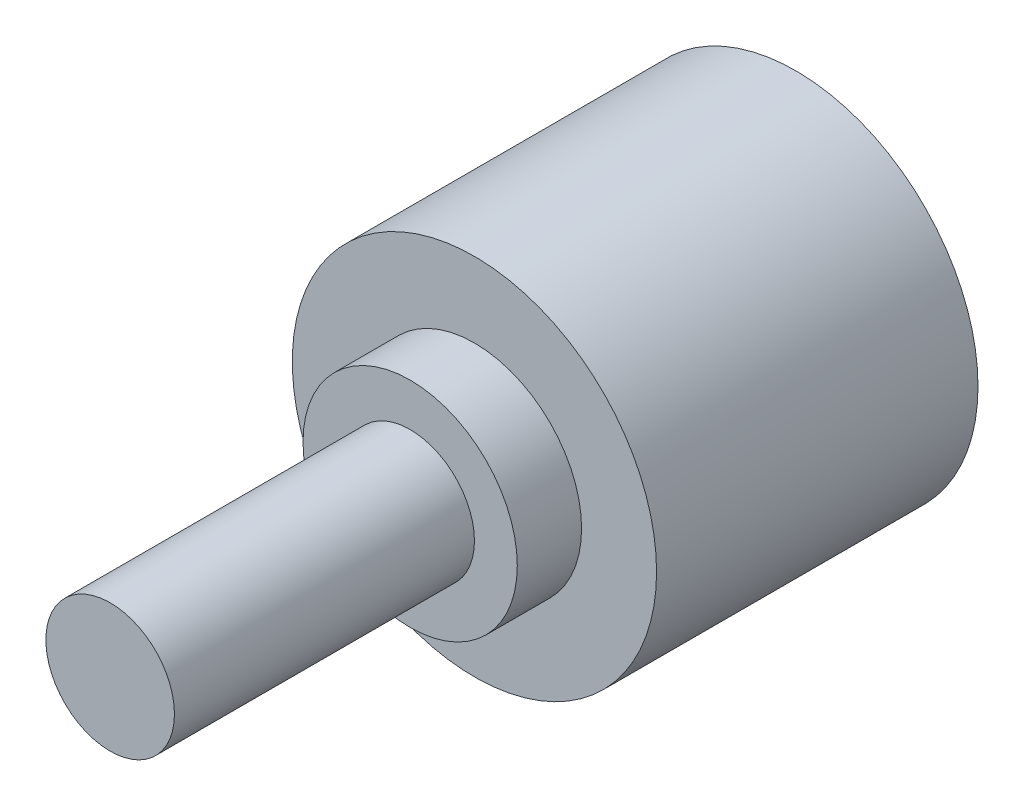
from build123d import *

# Parameters (mm, degrees)
SKETCH_1_R      = 3
EXTRUDE_1_DEPTH = 14
SKETCH_1_3_R    = 5
EXTRUDE_2_DEPTH = 3
EXTRUDE_START   = -3
SKETCH_1_4_R    = 8.5
EXTRUDE_3_DEPTH = 15


with BuildPart() as part:
    # 스케치1 → 보스-돌출1 (new body)
    with BuildSketch(Plane.XY):
        Circle(SKETCH_1_R)
    extrude(amount=EXTRUDE_1_DEPTH)

    # 스케치1<3> → 보스-돌출2 (add)
    with BuildSketch(Plane.XY):
        Circle(SKETCH_1_3_R)
    extrude(amount=-EXTRUDE_2_DEPTH)

    # 스케치1<4> → 보스-돌출3 (add)
    with BuildSketch(Plane.XY.offset(EXTRUDE_START)):
        Circle(SKETCH_1_4_R)
    extrude(amount=-EXTRUDE_3_DEPTH)


solid = part.part
